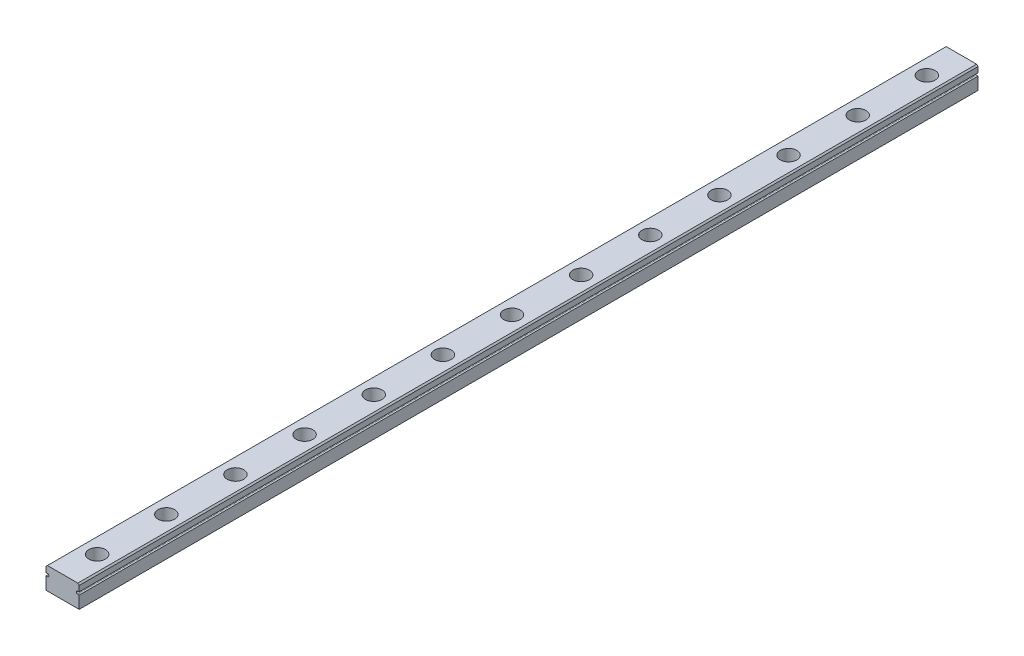
from build123d import *

# Parameters (mm, degrees)
BOSS_EXTRUDE1_DEPTH = 325
SKETCH3_R           = 1.5
CUT_EXTRUDE1_DEPTH  = 14
SKETCH4_R           = 3
CUT_EXTRUDE2_DEPTH  = 4.5
LPATTERN2_COUNT     = 14
LPATTERN2_PITCH     = 25


with BuildPart() as part:
    # Sketch1 → Boss-Extrude1 (new body)
    with BuildSketch(Plane.XY):
        with BuildLine():
            Line((-6, 1.5), (-5.4, 1.5))
            ThreePointArc((-5.4, 1.5), (-5.117157288, 1.382842712), (-5, 1.1))
            Line((-5, 1.1), (-5, 0.9))
            ThreePointArc((-5, 0.9), (-5.117157288, 0.617157288), (-5.4, 0.5))
            Line((-5.4, 0.5), (-6, 0.5))
            Line((-6, 0.5), (-6, -4))
            Line((-6, -4), (6, -4))
            Line((6, -4), (6, 0.5))
            Line((6, 0.5), (5.4, 0.5))
            ThreePointArc((5.4, 0.5), (5.117157288, 0.617157288), (5, 0.9))
            Line((5, 0.9), (5, 1.1))
            ThreePointArc((5, 1.1), (5.117157288, 1.382842712), (5.4, 1.5))
            Line((5.4, 1.5), (6, 1.5))
            Line((6, 1.5), (6, 3.5))
            Line((6, 3.5), (5.5, 4))
            Line((5.5, 4), (-5.5, 4))
            Line((-5.5, 4), (-6, 3.5))
            Line((-6, 3.5), (-6, 1.5))
        make_face()
    extrude(amount=BOSS_EXTRUDE1_DEPTH)

    # Sketch3 → Cut-Extrude1 (cut)
    with BuildSketch(Plane(origin=(0, 4, 0), x_dir=(1, 0, 0), z_dir=(0, 1, 0))):
        with Locations(Location((0, -312.5, 0), (0, 0, 270))):
            Circle(SKETCH3_R)
    cut_extrude1 = extrude(amount=-CUT_EXTRUDE1_DEPTH, mode=Mode.SUBTRACT)

    # Sketch4 → Cut-Extrude2 (cut)
    with BuildSketch(Plane(origin=(0, 4, 0), x_dir=(1, 0, 0), z_dir=(0, 1, 0))):
        with Locations(Location((0, -312.5, 0), (0, 0, 270))):
            Circle(SKETCH4_R)
    cut_extrude2 = extrude(amount=-CUT_EXTRUDE2_DEPTH, mode=Mode.SUBTRACT)

    # LPattern2: Cut-Extrude1, Cut-Extrude2 ×14
    with Locations(*[(0, 0, -i * LPATTERN2_PITCH) for i in range(1, LPATTERN2_COUNT)]):
        add(cut_extrude1, mode=Mode.SUBTRACT)
        add(cut_extrude2, mode=Mode.SUBTRACT)


solid = part.part
